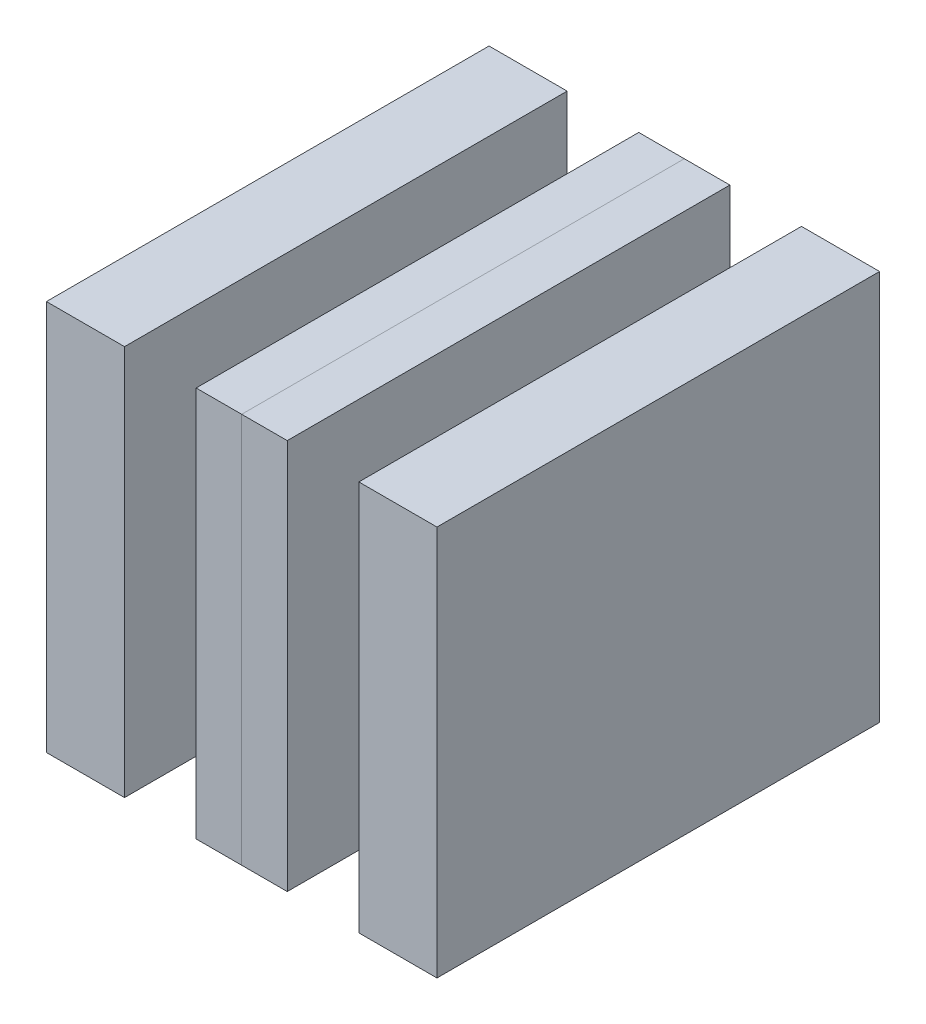
from build123d import *

# Parameters (mm, degrees)
SKETCH1_W             = 3
SKETCH1_H             = 15
BOSS_EXTRUDE1_DEPTH   = 17
SKETCH1_W_2           = 1.75
BOSS_EXTRUDE1_2_DEPTH = 17


with BuildPart() as part:
    # Sketch1 → Boss-Extrude1 (new body)
    with BuildSketch(Plane.XY):
        with Locations((1.5, 7.5)):
            Rectangle(SKETCH1_W, SKETCH1_H)
    extrude(amount=BOSS_EXTRUDE1_DEPTH)


with BuildPart() as body_2:
    # Sketch1 → Boss-Extrude1 2 (new body)
    with BuildSketch(Plane.XY):
        with Locations((6.625, 7.5)):
            Rectangle(SKETCH1_W_2, SKETCH1_H)
    extrude(amount=BOSS_EXTRUDE1_2_DEPTH)


with BuildPart() as body_3:
    # Mirror1: mirrored copy
    add(body_2.part.mirror(Plane(origin=(7.5, 15, 17), x_dir=(0, 0, 1), z_dir=(-1, 0, 0))))


with BuildPart() as body_4:
    # Mirror1 2: mirrored copy
    add(part.part.mirror(Plane(origin=(7.5, 15, 17), x_dir=(0, 0, 1), z_dir=(-1, 0, 0))))


solid = Compound([part.part, body_2.part, body_3.part, body_4.part])
